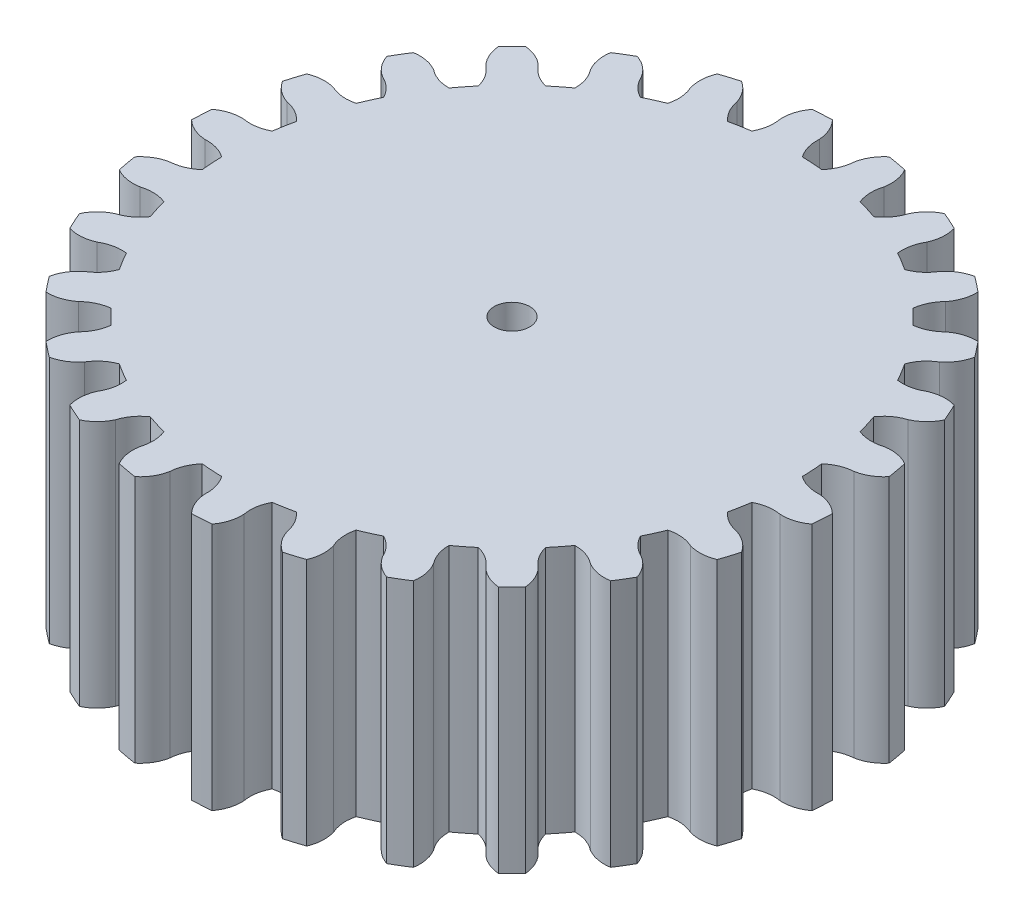
from build123d import *

# Parameters (mm, degrees)
CROQUIS1_R              = 18.66645
CROQUIS1_R_2            = 1
SALIENTE_EXTRUIR1_DEPTH = 14
CORTAR_EXTRUIR2_DEPTH   = 30.880975741


with BuildPart() as part:
    # Croquis1 → Saliente-Extruir1 (new body)
    with BuildSketch(Plane(origin=(0, 0, 0), x_dir=(1, 0, 0), z_dir=(0, 1, 0))):
        with Locations(Location((0, 0, 0), (0, 0, 270))):
            Circle(CROQUIS1_R)
        with Locations(Location((0, 0, 0), (0, 0, 270))):
            Circle(CROQUIS1_R_2, mode=Mode.SUBTRACT)
    extrude(amount=SALIENTE_EXTRUIR1_DEPTH)

    # Croquis3 → Cortar-Extruir2 (cut, through all)
    with BuildSketch(Plane(origin=(0, 14, 0), x_dir=(1, 0, 0), z_dir=(0, 1, 0))):
        with BuildLine():
            ThreePointArc((2.82630167, 18.451243169), (1.127738774, 18.632352532), (-0.580268164, 18.657428667))
            ThreePointArc((-0.580268164, 18.657428667), (-0.172200587, 18.04685725), (0, 17.33295))
            ThreePointArc((0, 17.33295), (0.076701819, 16.631248946), (0.382166362, 15.994885094))
            ThreePointArc((0.382166362, 15.994885094), (0.966611226, 15.970224264), (1.549763975, 15.924215269))
            ThreePointArc((1.549763975, 15.924215269), (1.929750365, 16.519091627), (2.090524311, 17.206419262))
            ThreePointArc((2.090524311, 17.206419262), (2.34757207, 17.894345895), (2.82630167, 18.451243169))
        make_face()
        with BuildLine():
            ThreePointArc((4.148046443, 16.829285974), (4.15169888, 17.563658675), (3.901608309, 18.25414496))
            ThreePointArc((3.901608309, 18.25414496), (5.553982558, 17.821044676), (7.159845996, 17.238705314))
            ThreePointArc((7.159845996, 17.238705314), (6.561753167, 16.812557956), (6.147543129, 16.206136775))
            ThreePointArc((6.147543129, 16.206136775), (5.826952713, 15.577257356), (5.315644806, 15.090603719))
            ThreePointArc((5.315644806, 15.090603719), (4.760448089, 15.274833364), (4.198887853, 15.438644406))
            ThreePointArc((4.198887853, 15.438644406), (4.054591393, 16.129619131), (4.148046443, 16.829285974))
        make_face()
        with BuildLine():
            ThreePointArc((8.055023505, 15.34756502), (8.234316699, 16.059724099), (8.15673749, 16.789996698))
            ThreePointArc((8.15673749, 16.789996698), (9.657449064, 15.974042481), (11.077286097, 15.024316567))
            ThreePointArc((11.077286097, 15.024316567), (10.394589021, 14.753685259), (9.847289087, 14.264012526))
            ThreePointArc((9.847289087, 14.264012526), (9.385513749, 13.730129509), (8.772599682, 13.379981133))
            ThreePointArc((8.772599682, 13.379981133), (8.277625013, 13.69172467), (7.771585245, 13.985165822))
            ThreePointArc((7.771585245, 13.985165822), (7.796842853, 14.690594481), (8.055023505, 15.34756502))
        make_face()
        with BuildLine():
            ThreePointArc((11.493871879, 12.973899373), (11.838385962, 13.622456733), (11.937826736, 14.350074858))
            ThreePointArc((11.937826736, 14.350074858), (13.199659733, 13.198687), (14.350954595, 11.936769153))
            ThreePointArc((14.350954595, 11.936769153), (13.623329144, 11.837382002), (12.974746396, 11.492915717))
            ThreePointArc((12.974746396, 11.492915717), (12.398622841, 11.085056441), (11.719722952, 10.891762678))
            ThreePointArc((11.719722952, 10.891762678), (11.313736459, 11.312902706), (10.892626351, 11.718920235))
            ThreePointArc((10.892626351, 11.718920235), (11.085970147, 12.397805877), (11.493871879, 12.973899373))
        make_face()
        with BuildLine():
            ThreePointArc((14.264738198, 9.846237852), (14.754451264, 10.393501697), (15.025132884, 11.076178827))
            ThreePointArc((15.025132884, 11.076178827), (15.974754158, 9.656271806), (16.790597776, 8.155500103))
            ThreePointArc((16.790597776, 8.155500103), (16.060330896, 8.233133131), (15.348158605, 8.053892421))
            ThreePointArc((15.348158605, 8.053892421), (14.691169041, 7.795760186), (13.985738523, 7.770554566))
            ThreePointArc((13.985738523, 7.770554566), (13.692334665, 8.276615958), (13.380627607, 8.7716136))
            ThreePointArc((13.380627607, 8.7716136), (13.730821151, 9.384501861), (14.264738198, 9.846237852))
        make_face()
        with BuildLine():
            ThreePointArc((16.206589784, 6.146348777), (16.813041488, 6.560514122), (17.239232923, 7.158575544))
            ThreePointArc((17.239232923, 7.158575544), (17.821453937, 5.552669194), (18.254432445, 3.900263032))
            ThreePointArc((18.254432445, 3.900263032), (17.563964593, 4.150404488), (16.829591625, 4.146806172))
            ThreePointArc((16.829591625, 4.146806172), (16.129917896, 4.053402685), (15.438953808, 4.197750067))
            ThreePointArc((15.438953808, 4.197750067), (15.275184151, 4.759322374), (15.090995422, 5.314532667))
            ThreePointArc((15.090995422, 5.314532667), (15.57768674, 5.825804707), (16.206589784, 6.146348777))
        make_face()
        with BuildLine():
            ThreePointArc((17.206573279, 2.089256252), (17.894518854, 2.346253313), (18.451451407, 2.82494187))
            ThreePointArc((18.451451407, 2.82494187), (18.632435591, 1.126365631), (18.657385852, -0.58164315))
            ThreePointArc((18.657385852, -0.58164315), (18.04684451, -0.173530577), (17.332949953, -0.001277378))
            ThreePointArc((17.332949953, -0.001277378), (16.631254553, 0.075476153), (15.994913215, 0.380987593))
            ThreePointArc((15.994913215, 0.380987593), (15.970295456, 0.965434274), (15.924329438, 1.548590412))
            ThreePointArc((15.924329438, 1.548590412), (16.519233798, 1.92853296), (17.206573279, 2.089256252))
        make_face()
        with BuildLine():
            ThreePointArc((17.206573279, -2.089256252), (17.936031828, -2.004363211), (18.591338604, -1.672867158))
            ThreePointArc((18.591338604, -1.672867158), (18.360567815, -3.365398208), (17.976039811, -5.029746347))
            ThreePointArc((17.976039811, -5.029746347), (17.480907422, -4.487380676), (16.828980232, -4.149286692))
            ThreePointArc((16.828980232, -4.149286692), (16.166043148, -3.906836778), (15.621306405, -3.457916495))
            ThreePointArc((15.621306405, -3.457916495), (15.73727124, -2.884561358), (15.832199309, -2.307350289))
            ThreePointArc((15.832199309, -2.307350289), (16.500743033, -2.080818113), (17.206573279, -2.089256252))
        make_face()
        with BuildLine():
            ThreePointArc((16.206589784, -6.146348777), (16.935167828, -6.238493431), (17.650764777, -6.073455226))
            ThreePointArc((17.650764777, -6.073455226), (17.021650576, -7.661577336), (16.249991676, -9.185538968))
            ThreePointArc((16.249991676, -9.185538968), (15.899043535, -8.540440521), (15.346971351, -8.056154545))
            ThreePointArc((15.346971351, -8.056154545), (14.761320076, -7.662098556), (14.339846049, -7.095859046))
            ThreePointArc((14.339846049, -7.095859046), (14.589654021, -6.566916768), (14.819959303, -6.029196177))
            ThreePointArc((14.819959303, -6.029196177), (15.523289061, -5.9692396), (16.206589784, -6.146348777))
        make_face()
        with BuildLine():
            ThreePointArc((14.264738198, -9.846237852), (14.950093429, -10.110065088), (15.68439266, -10.121076153))
            ThreePointArc((15.68439266, -10.121076153), (14.693496876, -11.512493438), (13.579553091, -12.807501452))
            ThreePointArc((13.579553091, -12.807501452), (13.393185029, -12.097161006), (12.973052279, -11.494827979))
            ThreePointArc((12.973052279, -11.494827979), (12.498722736, -10.972067017), (12.225005963, -10.321416061))
            ThreePointArc((12.225005963, -10.321416061), (12.594139142, -9.867626846), (12.946437132, -9.4006471))
            ThreePointArc((12.946437132, -9.4006471), (13.643677953, -9.510750579), (14.264738198, -9.846237852))
        make_face()
        with BuildLine():
            ThreePointArc((11.493871879, -12.973899373), (12.096173942, -13.394076511), (12.806500651, -13.580496923))
            ThreePointArc((12.806500651, -13.580496923), (11.511410547, -14.694345267), (10.11992024, -15.685138505))
            ThreePointArc((10.11992024, -15.685138505), (10.108963291, -14.950838465), (9.845186564, -14.265463793))
            ThreePointArc((9.845186564, -14.265463793), (9.509745062, -13.644378825), (9.399692967, -12.947129892))
            ThreePointArc((9.399692967, -12.947129892), (9.866698674, -12.594866318), (10.320515093, -12.225766582))
            ThreePointArc((10.320515093, -12.225766582), (10.971145875, -12.499531305), (11.493871879, -12.973899373))
        make_face()
        with BuildLine():
            ThreePointArc((8.055023505, -15.34756502), (8.539268794, -15.899672893), (9.184341375, -16.250668574))
            ThreePointArc((9.184341375, -16.250668574), (7.660322879, -17.022215161), (6.07215441, -17.651212322))
            ThreePointArc((6.07215441, -17.651212322), (6.237245351, -16.935627537), (6.145154391, -16.207042704))
            ThreePointArc((6.145154391, -16.207042704), (5.968095572, -15.523728931), (6.028103982, -14.820403594))
            ThreePointArc((6.028103982, -14.820403594), (6.565841543, -14.590137941), (7.09480223, -14.34036895))
            ThreePointArc((7.09480223, -14.34036895), (7.661010678, -14.761884706), (8.055023505, -15.34756502))
        make_face()
        with BuildLine():
            ThreePointArc((4.148046443, -16.829285974), (4.486092382, -17.481238079), (5.028421561, -17.976410437))
            ThreePointArc((5.028421561, -17.976410437), (3.364045089, -18.360815784), (1.671497036, -18.591461838))
            ThreePointArc((1.671497036, -18.591461838), (2.003041383, -17.936179494), (2.087988182, -17.206727203))
            ThreePointArc((2.087988182, -17.206727203), (2.07960206, -16.500896337), (2.306183504, -15.832369309))
            ThreePointArc((2.306183504, -15.832369309), (2.883401568, -15.737483779), (3.45676525, -15.621561199))
            ThreePointArc((3.45676525, -15.621561199), (3.905645386, -16.166331024), (4.148046443, -16.829285974))
        make_face()
        with BuildLine():
            ThreePointArc((0, -17.33295), (0.172200587, -18.04685725), (0.580268164, -18.657428667))
            ThreePointArc((0.580268164, -18.657428667), (-1.127738774, -18.632352532), (-2.82630167, -18.451243169))
            ThreePointArc((-2.82630167, -18.451243169), (-2.34757207, -17.894345895), (-2.090524311, -17.206419262))
            ThreePointArc((-2.090524311, -17.206419262), (-1.929750365, -16.519091627), (-1.549763975, -15.924215269))
            ThreePointArc((-1.549763975, -15.924215269), (-0.966611226, -15.970224264), (-0.382166362, -15.994885094))
            ThreePointArc((-0.382166362, -15.994885094), (-0.076701819, -16.631248946), (0, -17.33295))
        make_face()
        with BuildLine():
            ThreePointArc((-4.148046443, -16.829285974), (-4.15169888, -17.563658675), (-3.901608309, -18.25414496))
            ThreePointArc((-3.901608309, -18.25414496), (-5.553982558, -17.821044676), (-7.159845996, -17.238705314))
            ThreePointArc((-7.159845996, -17.238705314), (-6.561753167, -16.812557956), (-6.147543129, -16.206136775))
            ThreePointArc((-6.147543129, -16.206136775), (-5.826952713, -15.577257356), (-5.315644806, -15.090603719))
            ThreePointArc((-5.315644806, -15.090603719), (-4.760448089, -15.274833364), (-4.198887853, -15.438644406))
            ThreePointArc((-4.198887853, -15.438644406), (-4.054591393, -16.129619131), (-4.148046443, -16.829285974))
        make_face()
        with BuildLine():
            ThreePointArc((-8.055023505, -15.34756502), (-8.234316699, -16.059724099), (-8.15673749, -16.789996698))
            ThreePointArc((-8.15673749, -16.789996698), (-9.657449064, -15.974042481), (-11.077286097, -15.024316567))
            ThreePointArc((-11.077286097, -15.024316567), (-10.394589021, -14.753685259), (-9.847289087, -14.264012526))
            ThreePointArc((-9.847289087, -14.264012526), (-9.385513749, -13.730129509), (-8.772599682, -13.379981133))
            ThreePointArc((-8.772599682, -13.379981133), (-8.277625013, -13.69172467), (-7.771585245, -13.985165822))
            ThreePointArc((-7.771585245, -13.985165822), (-7.796842853, -14.690594481), (-8.055023505, -15.34756502))
        make_face()
        with BuildLine():
            ThreePointArc((-11.493871879, -12.973899373), (-11.838385962, -13.622456733), (-11.937826736, -14.350074858))
            ThreePointArc((-11.937826736, -14.350074858), (-13.199659733, -13.198687), (-14.350954595, -11.936769153))
            ThreePointArc((-14.350954595, -11.936769153), (-13.623329144, -11.837382002), (-12.974746396, -11.492915717))
            ThreePointArc((-12.974746396, -11.492915717), (-12.398622841, -11.085056441), (-11.719722952, -10.891762678))
            ThreePointArc((-11.719722952, -10.891762678), (-11.313736459, -11.312902706), (-10.892626351, -11.718920235))
            ThreePointArc((-10.892626351, -11.718920235), (-11.085970147, -12.397805877), (-11.493871879, -12.973899373))
        make_face()
        with BuildLine():
            ThreePointArc((-14.264738198, -9.846237852), (-14.754451264, -10.393501697), (-15.025132884, -11.076178827))
            ThreePointArc((-15.025132884, -11.076178827), (-15.974754158, -9.656271806), (-16.790597776, -8.155500103))
            ThreePointArc((-16.790597776, -8.155500103), (-16.060330896, -8.233133131), (-15.348158605, -8.053892421))
            ThreePointArc((-15.348158605, -8.053892421), (-14.691169041, -7.795760186), (-13.985738523, -7.770554566))
            ThreePointArc((-13.985738523, -7.770554566), (-13.692334665, -8.276615958), (-13.380627607, -8.7716136))
            ThreePointArc((-13.380627607, -8.7716136), (-13.730821151, -9.384501861), (-14.264738198, -9.846237852))
        make_face()
        with BuildLine():
            ThreePointArc((-16.206589784, -6.146348777), (-16.813041488, -6.560514122), (-17.239232923, -7.158575544))
            ThreePointArc((-17.239232923, -7.158575544), (-17.821453937, -5.552669194), (-18.254432445, -3.900263032))
            ThreePointArc((-18.254432445, -3.900263032), (-17.563964593, -4.150404488), (-16.829591625, -4.146806172))
            ThreePointArc((-16.829591625, -4.146806172), (-16.129917896, -4.053402685), (-15.438953808, -4.197750067))
            ThreePointArc((-15.438953808, -4.197750067), (-15.275184151, -4.759322374), (-15.090995422, -5.314532667))
            ThreePointArc((-15.090995422, -5.314532667), (-15.57768674, -5.825804707), (-16.206589784, -6.146348777))
        make_face()
        with BuildLine():
            ThreePointArc((-17.206573279, -2.089256252), (-17.894518854, -2.346253313), (-18.451451407, -2.82494187))
            ThreePointArc((-18.451451407, -2.82494187), (-18.632435591, -1.126365631), (-18.657385852, 0.58164315))
            ThreePointArc((-18.657385852, 0.58164315), (-18.04684451, 0.173530577), (-17.332949953, 0.001277378))
            ThreePointArc((-17.332949953, 0.001277378), (-16.631254553, -0.075476153), (-15.994913215, -0.380987593))
            ThreePointArc((-15.994913215, -0.380987593), (-15.970295456, -0.965434274), (-15.924329438, -1.548590412))
            ThreePointArc((-15.924329438, -1.548590412), (-16.519233798, -1.92853296), (-17.206573279, -2.089256252))
        make_face()
        with BuildLine():
            ThreePointArc((-17.206573279, 2.089256252), (-17.936031828, 2.004363211), (-18.591338604, 1.672867158))
            ThreePointArc((-18.591338604, 1.672867158), (-18.360567815, 3.365398208), (-17.976039811, 5.029746347))
            ThreePointArc((-17.976039811, 5.029746347), (-17.480907422, 4.487380676), (-16.828980232, 4.149286692))
            ThreePointArc((-16.828980232, 4.149286692), (-16.166043148, 3.906836778), (-15.621306405, 3.457916495))
            ThreePointArc((-15.621306405, 3.457916495), (-15.73727124, 2.884561358), (-15.832199309, 2.307350289))
            ThreePointArc((-15.832199309, 2.307350289), (-16.500743033, 2.080818113), (-17.206573279, 2.089256252))
        make_face()
        with BuildLine():
            ThreePointArc((-16.206589784, 6.146348777), (-16.935167828, 6.238493431), (-17.650764777, 6.073455226))
            ThreePointArc((-17.650764777, 6.073455226), (-17.021650576, 7.661577336), (-16.249991676, 9.185538968))
            ThreePointArc((-16.249991676, 9.185538968), (-15.899043535, 8.540440521), (-15.346971351, 8.056154545))
            ThreePointArc((-15.346971351, 8.056154545), (-14.761320076, 7.662098556), (-14.339846049, 7.095859046))
            ThreePointArc((-14.339846049, 7.095859046), (-14.589654021, 6.566916768), (-14.819959303, 6.029196177))
            ThreePointArc((-14.819959303, 6.029196177), (-15.523289061, 5.9692396), (-16.206589784, 6.146348777))
        make_face()
        with BuildLine():
            ThreePointArc((-14.264738198, 9.846237852), (-14.950093429, 10.110065088), (-15.68439266, 10.121076153))
            ThreePointArc((-15.68439266, 10.121076153), (-14.693496876, 11.512493438), (-13.579553091, 12.807501452))
            ThreePointArc((-13.579553091, 12.807501452), (-13.393185029, 12.097161006), (-12.973052279, 11.494827979))
            ThreePointArc((-12.973052279, 11.494827979), (-12.498722736, 10.972067017), (-12.225005963, 10.321416061))
            ThreePointArc((-12.225005963, 10.321416061), (-12.594139142, 9.867626846), (-12.946437132, 9.4006471))
            ThreePointArc((-12.946437132, 9.4006471), (-13.643677953, 9.510750579), (-14.264738198, 9.846237852))
        make_face()
        with BuildLine():
            ThreePointArc((-11.493871879, 12.973899373), (-12.096173942, 13.394076511), (-12.806500651, 13.580496923))
            ThreePointArc((-12.806500651, 13.580496923), (-11.511410547, 14.694345267), (-10.11992024, 15.685138505))
            ThreePointArc((-10.11992024, 15.685138505), (-10.108963291, 14.950838465), (-9.845186564, 14.265463793))
            ThreePointArc((-9.845186564, 14.265463793), (-9.509745062, 13.644378825), (-9.399692967, 12.947129892))
            ThreePointArc((-9.399692967, 12.947129892), (-9.866698674, 12.594866318), (-10.320515093, 12.225766582))
            ThreePointArc((-10.320515093, 12.225766582), (-10.971145875, 12.499531305), (-11.493871879, 12.973899373))
        make_face()
        with BuildLine():
            ThreePointArc((-8.055023505, 15.34756502), (-8.539268794, 15.899672893), (-9.184341375, 16.250668574))
            ThreePointArc((-9.184341375, 16.250668574), (-7.660322879, 17.022215161), (-6.07215441, 17.651212322))
            ThreePointArc((-6.07215441, 17.651212322), (-6.237245351, 16.935627537), (-6.145154391, 16.207042704))
            ThreePointArc((-6.145154391, 16.207042704), (-5.968095572, 15.523728931), (-6.028103982, 14.820403594))
            ThreePointArc((-6.028103982, 14.820403594), (-6.565841543, 14.590137941), (-7.09480223, 14.34036895))
            ThreePointArc((-7.09480223, 14.34036895), (-7.661010678, 14.761884706), (-8.055023505, 15.34756502))
        make_face()
        with BuildLine():
            ThreePointArc((-4.148046443, 16.829285974), (-4.486092382, 17.481238079), (-5.028421561, 17.976410437))
            ThreePointArc((-5.028421561, 17.976410437), (-3.364045089, 18.360815784), (-1.671497036, 18.591461838))
            ThreePointArc((-1.671497036, 18.591461838), (-2.003041383, 17.936179494), (-2.087988182, 17.206727203))
            ThreePointArc((-2.087988182, 17.206727203), (-2.07960206, 16.500896337), (-2.306183504, 15.832369309))
            ThreePointArc((-2.306183504, 15.832369309), (-2.883401568, 15.737483779), (-3.45676525, 15.621561199))
            ThreePointArc((-3.45676525, 15.621561199), (-3.905645386, 16.166331024), (-4.148046443, 16.829285974))
        make_face()
    extrude(amount=-CORTAR_EXTRUIR2_DEPTH, mode=Mode.SUBTRACT)


solid = part.part
